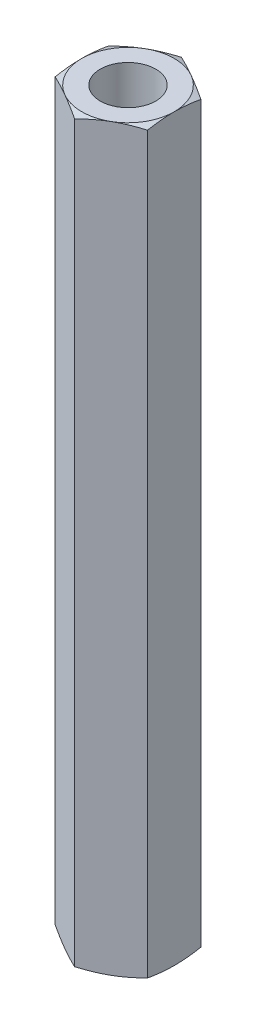
from build123d import *

# Parameters (mm, degrees)
SKETCH1_R           = 1.5
BOSS_EXTRUDE1_DEPTH = 40


with BuildPart() as part:
    # Sketch1 → Boss-Extrude1 (new body)
    with BuildSketch(Plane(origin=(0, 0, 0), x_dir=(1, 0, 0), z_dir=(0, 1, 0))):
        Polygon((0, 2.886751346), (-2.5, 1.443375673), (-2.5, -1.443375673), (0, -2.886751346), (2.5, -1.443375673), (2.5, 1.443375673), align=None)
        with Locations(Location((0, 0, 0), (0, 0, 270))):
            Circle(SKETCH1_R, mode=Mode.SUBTRACT)
    extrude(amount=BOSS_EXTRUDE1_DEPTH)

    # Sketch6 → Cut-Revolve1 (revolve, cut)
    with BuildSketch(Plane.ZY):
        Polygon((2.5, 40), (2.886751346, 40), (2.886751346, 39.859234022), align=None)
    cut_revolve1 = revolve(axis=Axis((0, 40, 0), (0, 1, 0)), mode=Mode.SUBTRACT)

    # Mirror1: Cut-Revolve1 across plane
    add(cut_revolve1.mirror(Plane.ZX.offset(20)), mode=Mode.SUBTRACT)


solid = part.part
